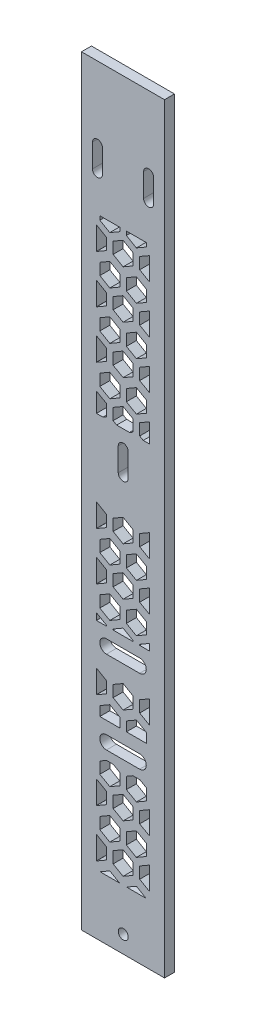
from build123d import *

# Parameters (mm, degrees)
SKETCH1_W           = 25
SKETCH1_H           = 229.0607495
SKETCH1_R           = 1.5
BOSS_EXTRUDE1_DEPTH = 3
CUT_EXTRUDE1_DEPTH  = 118.265539563
CUT_EXTRUDE2_DEPTH  = 118.265539563
CUT_EXTRUDE3_DEPTH  = 10


with BuildPart() as part:
    # Sketch1 → Boss-Extrude1 (new body)
    with BuildSketch(Plane.XY):
        with Locations((12.5, 0)):
            Rectangle(SKETCH1_W, SKETCH1_H)
        with Locations((4.8, 89.13037475)):
            Circle(SKETCH1_R, mode=Mode.SUBTRACT)
        with Locations((20.2, 89.13037475)):
            Circle(SKETCH1_R, mode=Mode.SUBTRACT)
        with Locations((12.55876, 13.772227202)):
            Circle(SKETCH1_R, mode=Mode.SUBTRACT)
        with BuildLine():
            add(Edge.make_bspline(
                [(11.075, -109.328089672), (11.075, -112.328089671), (14.075, -112.328089671), (14.075, -109.328089672), (14.075, -106.328089673), (11.075, -106.328089673), (11.075, -109.328089672)],
                knots=[0, 0, 0, 0, 0.5, 0.5, 0.5, 1, 1, 1, 1], degree=3, weights=[1, 0.333333333, 0.333333333, 1, 0.333333333, 0.333333333, 1]))
        make_face(mode=Mode.SUBTRACT)
    extrude(amount=BOSS_EXTRUDE1_DEPTH)

    # Sketch2 → Cut-Extrude1 (cut, through all)
    with BuildSketch(Plane.XY.offset(3)):
        with BuildLine():
            Line((7.5, -34.813160449), (17.5, -34.813160449))
            ThreePointArc((17.5, -34.813160449), (19.5, -36.813160449), (17.5, -38.813160449))
            Line((17.5, -38.813160449), (7.5, -38.813160449))
            ThreePointArc((7.5, -38.813160449), (5.5, -36.813160449), (7.5, -34.813160449))
        make_face()
        with BuildLine():
            Line((7.5, -63.813160449), (17.5, -63.813160449))
            ThreePointArc((17.5, -63.813160449), (19.5, -61.813160449), (17.5, -59.813160449))
            Line((17.5, -59.813160449), (7.5, -59.813160449))
            ThreePointArc((7.5, -59.813160449), (5.5, -61.813160449), (7.5, -63.813160449))
        make_face()
    extrude(amount=-CUT_EXTRUDE1_DEPTH, mode=Mode.SUBTRACT)

    # Sketch3 → Cut-Extrude2 (cut, through all)
    with BuildSketch(Plane.XY.offset(3)):
        with BuildLine():
            Line((6.3, 92.63037475), (6.3, 85.63037475))
            ThreePointArc((6.3, 85.63037475), (4.8, 84.13037475), (3.3, 85.63037475))
            Line((3.3, 85.63037475), (3.3, 92.63037475))
            ThreePointArc((3.3, 92.63037475), (4.8, 94.13037475), (6.3, 92.63037475))
        make_face()
        with BuildLine():
            Line((18.7, 92.63037475), (18.7, 85.63037475))
            ThreePointArc((18.7, 85.63037475), (20.2, 84.13037475), (21.7, 85.63037475))
            Line((21.7, 85.63037475), (21.7, 92.63037475))
            ThreePointArc((21.7, 92.63037475), (20.2, 94.13037475), (18.7, 92.63037475))
        make_face()
        with BuildLine():
            Line((14.05876, 17.272227202), (14.05876, 10.272227202))
            ThreePointArc((14.05876, 10.272227202), (12.55876, 8.772227202), (11.05876, 10.272227202))
            Line((11.05876, 10.272227202), (11.05876, 17.272227202))
            ThreePointArc((11.05876, 17.272227202), (12.55876, 18.772227202), (14.05876, 17.272227202))
        make_face()
    extrude(amount=-CUT_EXTRUDE2_DEPTH, mode=Mode.SUBTRACT)

    # Sketch4 → Cut-Extrude3 (cut)
    with BuildSketch(Plane.XY.offset(3)):
        Polygon((8.520355389, -94.839847362), (5.59227606, -96.53037475), (11.448434718, -96.53037475), align=None)
        Polygon((16.520355389, -94.839847362), (13.59227606, -96.53037475), (19.448434718, -96.53037475), align=None)
        Polygon((20.5, -94.234501633), (20.5, -87.329802781), (17.520355389, -89.050101399), (17.520355389, -92.514203015), align=None)
        Polygon((9.520355389, -92.514203015), (12.520355389, -94.246253822), (15.520355389, -92.514203015), (15.520355389, -89.050101399), (12.520355389, -87.318050592), (9.520355389, -89.050101399), align=None)
        Polygon((4.520355389, -87.318050592), (4.5, -87.329802781), (4.5, -94.234501633), (4.520355389, -94.246253822), (7.520355389, -92.514203015), (7.520355389, -89.050101399), align=None)
        Polygon((5.520355389, -85.585999784), (8.520355389, -87.318050592), (11.520355389, -85.585999784), (11.520355389, -82.121898169), (8.520355389, -80.389847362), (5.520355389, -82.121898169), align=None)
        Polygon((13.520355389, -85.585999784), (16.520355389, -87.318050592), (19.520355389, -85.585999784), (19.520355389, -82.121898169), (16.520355389, -80.389847362), (13.520355389, -82.121898169), align=None)
        Polygon((20.5, -79.784501633), (20.5, -72.879802781), (17.520355389, -74.600101399), (17.520355389, -78.064203015), align=None)
        Polygon((9.520355389, -78.064203015), (12.520355389, -79.796253822), (15.520355389, -78.064203015), (15.520355389, -74.600101399), (12.520355389, -72.868050592), (9.520355389, -74.600101399), align=None)
        Polygon((4.520355389, -72.868050592), (4.5, -72.879802781), (4.5, -79.784501633), (4.520355389, -79.796253822), (7.520355389, -78.064203015), (7.520355389, -74.600101399), align=None)
        Polygon((17.54317883, -66.53037475), (15.497531948, -66.53037475), (13.520355389, -67.671898169), (13.520355389, -71.135999784), (16.520355389, -72.868050592), (19.520355389, -71.135999784), (19.520355389, -67.671898169), align=None)
        Polygon((9.54317883, -66.53037475), (7.497531948, -66.53037475), (5.520355389, -67.671898169), (5.520355389, -71.135999784), (8.520355389, -72.868050592), (11.520355389, -71.135999784), (11.520355389, -67.671898169), align=None)
        Polygon((5.520355389, -53.221898169), (5.520355389, -56.071638707), (11.520355389, -56.071638707), (11.520355389, -53.221898169), (8.520355389, -51.489847362), align=None)
        Polygon((13.520355389, -53.221898169), (13.520355389, -56.071638707), (19.520355389, -56.071638707), (19.520355389, -53.221898169), (16.520355389, -51.489847362), align=None)
        Polygon((20.5, -50.884501633), (20.5, -43.979802781), (17.520355389, -45.700101399), (17.520355389, -49.164203015), align=None)
        Polygon((9.520355389, -49.164203015), (12.520355389, -50.896253822), (15.520355389, -49.164203015), (15.520355389, -45.700101399), (12.520355389, -43.968050592), (9.520355389, -45.700101399), align=None)
        Polygon((4.520355389, -43.968050592), (4.5, -43.979802781), (4.5, -50.884501633), (4.520355389, -50.896253822), (7.520355389, -49.164203015), (7.520355389, -45.700101399), align=None)
        Polygon((4.5, -29.529802781), (4.5, -31.53037475), (7.520355389, -31.53037475), (7.520355389, -31.250101399), (4.520355389, -29.518050592), align=None)
        Polygon((9.520355389, -31.250101399), (9.520355389, -31.53037475), (15.520355389, -31.53037475), (15.520355389, -31.250101399), (12.520355389, -29.518050592), align=None)
        Polygon((17.520355389, -31.250101399), (17.520355389, -31.53037475), (20.5, -31.53037475), (20.5, -29.529802781), align=None)
        Polygon((13.520355389, -27.785999784), (16.520355389, -29.518050592), (19.520355389, -27.785999784), (19.520355389, -24.321898169), (16.520355389, -22.589847362), (13.520355389, -24.321898169), align=None)
        Polygon((5.520355389, -27.785999784), (8.520355389, -29.518050592), (11.520355389, -27.785999784), (11.520355389, -24.321898169), (8.520355389, -22.589847362), (5.520355389, -24.321898169), align=None)
        Polygon((17.520355389, -20.264203015), (20.5, -21.984501633), (20.5, -15.079802781), (17.520355389, -16.800101399), align=None)
        Polygon((9.520355389, -20.264203015), (12.520355389, -21.996253822), (15.520355389, -20.264203015), (15.520355389, -16.800101399), (12.520355389, -15.068050592), (9.520355389, -16.800101399), align=None)
        Polygon((4.5, -15.079802781), (4.5, -21.984501633), (4.520355389, -21.996253822), (7.520355389, -20.264203015), (7.520355389, -16.800101399), (4.520355389, -15.068050592), align=None)
        Polygon((5.520355389, -13.335999784), (8.520355389, -15.068050592), (11.520355389, -13.335999784), (11.520355389, -9.871898169), (8.520355389, -8.139847362), (5.520355389, -9.871898169), align=None)
        Polygon((13.520355389, -13.335999784), (16.520355389, -15.068050592), (19.520355389, -13.335999784), (19.520355389, -9.871898169), (16.520355389, -8.139847362), (13.520355389, -9.871898169), align=None)
        Polygon((17.520355389, -5.814203015), (20.5, -7.534501633), (20.5, -0.629802781), (17.520355389, -2.350101399), align=None)
        Polygon((9.520355389, -5.814203015), (12.520355389, -7.546253822), (15.520355389, -5.814203015), (15.520355389, -2.350101399), (12.520355389, -0.618050592), (9.520355389, -2.350101399), align=None)
        Polygon((4.5, -0.629802781), (4.5, -7.534501633), (4.520355389, -7.546253822), (7.520355389, -5.814203015), (7.520355389, -2.350101399), (4.520355389, -0.618050592), align=None)
        Polygon((4.5, 28.270197219), (4.5, 22.46962525), (6.453114636, 22.46962525), (7.520355389, 23.085796985), (7.520355389, 26.549898601), (4.520355389, 28.281949408), align=None)
        Polygon((9.520355389, 23.085796985), (10.587596142, 22.46962525), (14.453114636, 22.46962525), (15.520355389, 23.085796985), (15.520355389, 26.549898601), (12.520355389, 28.281949408), (9.520355389, 26.549898601), align=None)
        Polygon((17.520355389, 23.085796985), (18.587596142, 22.46962525), (20.5, 22.46962525), (20.5, 28.270197219), (17.520355389, 26.549898601), align=None)
        Polygon((13.520355389, 30.014000216), (16.520355389, 28.281949408), (19.520355389, 30.014000216), (19.520355389, 33.478101831), (16.520355389, 35.210152638), (13.520355389, 33.478101831), align=None)
        Polygon((5.520355389, 30.014000216), (8.520355389, 28.281949408), (11.520355389, 30.014000216), (11.520355389, 33.478101831), (8.520355389, 35.210152638), (5.520355389, 33.478101831), align=None)
        Polygon((17.520355389, 37.535796985), (20.5, 35.815498367), (20.5, 42.720197219), (17.520355389, 40.999898601), align=None)
        Polygon((9.520355389, 37.535796985), (12.520355389, 35.803746178), (15.520355389, 37.535796985), (15.520355389, 40.999898601), (12.520355389, 42.731949408), (9.520355389, 40.999898601), align=None)
        Polygon((4.5, 42.720197219), (4.5, 35.815498367), (4.520355389, 35.803746178), (7.520355389, 37.535796985), (7.520355389, 40.999898601), (4.520355389, 42.731949408), align=None)
        Polygon((5.520355389, 44.464000216), (8.520355389, 42.731949408), (11.520355389, 44.464000216), (11.520355389, 47.928101831), (8.520355389, 49.660152638), (5.520355389, 47.928101831), align=None)
        Polygon((13.520355389, 44.464000216), (16.520355389, 42.731949408), (19.520355389, 44.464000216), (19.520355389, 47.928101831), (16.520355389, 49.660152638), (13.520355389, 47.928101831), align=None)
        Polygon((17.520355389, 51.985796985), (20.5, 50.265498367), (20.5, 57.170197219), (17.520355389, 55.449898601), align=None)
        Polygon((9.520355389, 51.985796985), (12.520355389, 50.253746178), (15.520355389, 51.985796985), (15.520355389, 55.449898601), (12.520355389, 57.181949408), (9.520355389, 55.449898601), align=None)
        Polygon((4.5, 57.170197219), (4.5, 50.265498367), (4.520355389, 50.253746178), (7.520355389, 51.985796985), (7.520355389, 55.449898601), (4.520355389, 57.181949408), align=None)
        Polygon((5.520355389, 58.914000216), (8.520355389, 57.181949408), (11.520355389, 58.914000216), (11.520355389, 62.378101831), (8.520355389, 64.110152638), (5.520355389, 62.378101831), align=None)
        Polygon((13.520355389, 58.914000216), (16.520355389, 57.181949408), (19.520355389, 58.914000216), (19.520355389, 62.378101831), (16.520355389, 64.110152638), (13.520355389, 62.378101831), align=None)
        Polygon((17.520355389, 66.435796985), (20.5, 64.715498367), (20.5, 71.620197219), (17.520355389, 69.899898601), align=None)
        Polygon((9.520355389, 66.435796985), (12.520355389, 64.703746178), (15.520355389, 66.435796985), (15.520355389, 69.899898601), (12.520355389, 71.631949408), (9.520355389, 69.899898601), align=None)
        Polygon((4.5, 71.620197219), (4.5, 64.715498367), (4.520355389, 64.703746178), (7.520355389, 66.435796985), (7.520355389, 69.899898601), (4.520355389, 71.631949408), align=None)
        Polygon((11.520355389, 74.53037475), (5.520355389, 74.53037475), (5.520355389, 73.364000216), (8.520355389, 71.631949408), (11.520355389, 73.364000216), align=None)
        Polygon((19.520355389, 74.53037475), (13.520355389, 74.53037475), (13.520355389, 73.364000216), (16.520355389, 71.631949408), (19.520355389, 73.364000216), align=None)
    extrude(amount=-CUT_EXTRUDE3_DEPTH, mode=Mode.SUBTRACT)


solid = part.part
